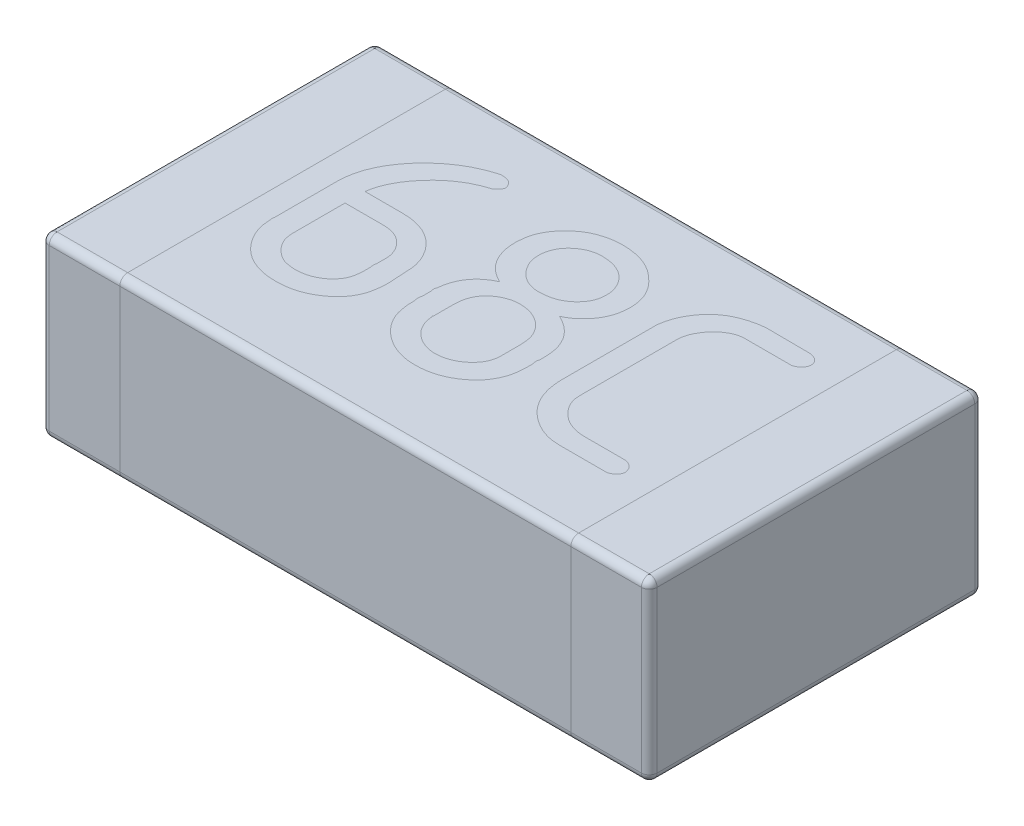
from build123d import *

# Parameters (mm, degrees)
BOSS_EXTRUDE1_DEPTH = 0.225
FILLET2_R           = 0.02


with BuildPart() as part:
    # Sketch1 → Boss-Extrude1 (new, symmetric)
    with BuildSketch(Plane(origin=(0, 0, 0), x_dir=(1, 0, 0), z_dir=(0, 1, 0))):
        with BuildLine():
            Line((-0.755, -0.425), (0.755, -0.425))
            ThreePointArc((0.755, -0.425), (0.769142136, -0.419142136), (0.775, -0.405))
            Line((0.775, -0.405), (0.775, 0.405))
            ThreePointArc((0.775, 0.405), (0.769142136, 0.419142136), (0.755, 0.425))
            Line((0.755, 0.425), (-0.755, 0.425))
            ThreePointArc((-0.755, 0.425), (-0.769142136, 0.419142136), (-0.775, 0.405))
            Line((-0.775, 0.405), (-0.775, -0.405))
            ThreePointArc((-0.775, -0.405), (-0.769142136, -0.419142136), (-0.755, -0.425))
        make_face()
    extrude(amount=BOSS_EXTRUDE1_DEPTH, both=True)

    # Fillet2
    fillet2_edges = [part.edges().sort_by_distance(p)[0] for p in [
        (0.769142136, 0.225, 0.419142136),
        (0, -0.225, 0.425),
        (-0.769142136, -0.225, 0.419142136),
        (0, 0.225, 0.425),
        (0, 0.225, -0.425),
        (0, 0.225, -0.425),
        (0, 0.225, 0.425),
        (0.775, 0.225, 0),
        (0, -0.225, 0.425),
        (0, -0.225, 0.425),
        (0, -0.225, -0.425),
        (0, -0.225, -0.425),
        (0.769142136, 0.225, -0.419142136),
        (0, 0.225, -0.425),
        (-0.769142136, 0.225, -0.419142136),
        (-0.775, 0.225, 0),
        (-0.769142136, 0.225, 0.419142136),
        (0, 0.225, 0.425),
        (-0.775, -0.225, 0),
        (-0.769142136, -0.225, -0.419142136),
        (0, -0.225, -0.425),
        (0.769142136, -0.225, -0.419142136),
        (0.775, -0.225, 0),
        (0.769142136, -0.225, 0.419142136),
    ]]
    fillet(fillet2_edges, radius=FILLET2_R)


solid = part.part
